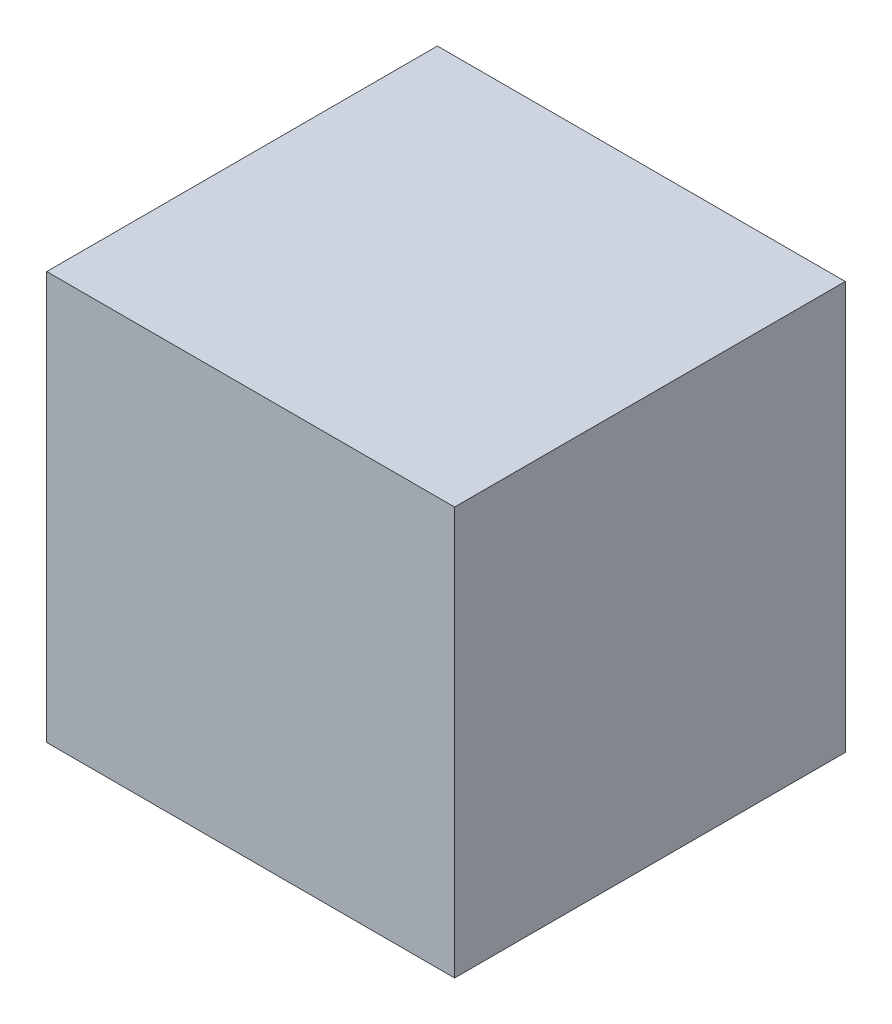
from build123d import *

# Parameters (mm, degrees)
SKETCH1_W           = 38
SKETCH1_H           = 36.4
BOSS_EXTRUDE1_DEPTH = 38


with BuildPart() as part:
    # Sketch1 → Boss-Extrude1 (new body)
    with BuildSketch(Plane(origin=(0, 0, 0), x_dir=(1, 0, 0), z_dir=(0, 1, 0))):
        with Locations((19, 18.2)):
            Rectangle(SKETCH1_W, SKETCH1_H)
    extrude(amount=BOSS_EXTRUDE1_DEPTH)


solid = part.part
